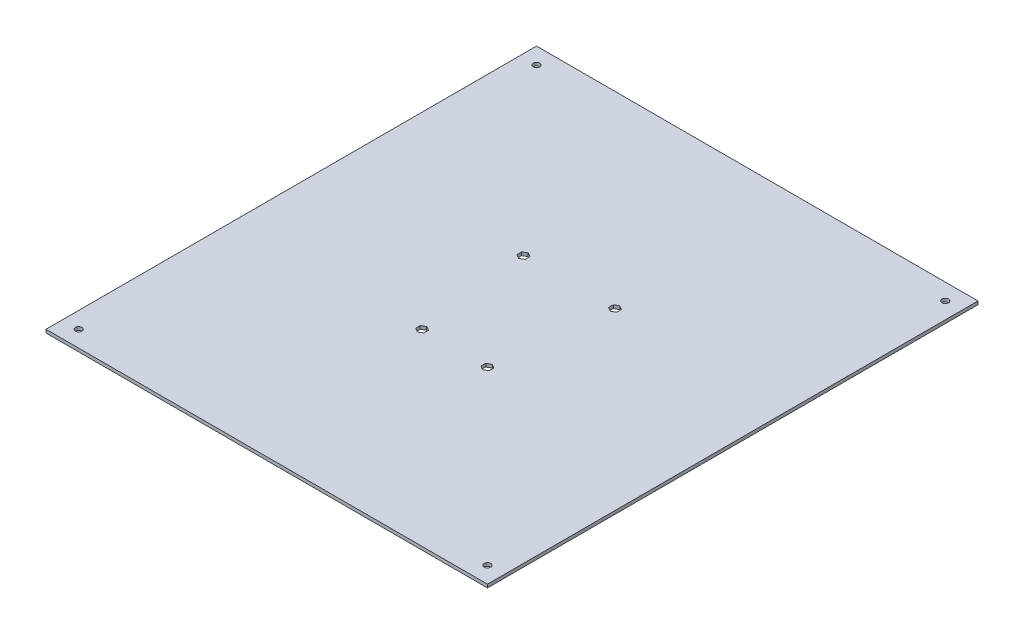
from build123d import *

# Parameters (mm, degrees)
SKETCH1_W           = 270
SKETCH1_H           = 300
SKETCH1_R           = 2
BOSS_EXTRUDE1_DEPTH = 2
CUT_EXTRUDE1_DEPTH  = 145


with BuildPart() as part:
    # Sketch1 → Boss-Extrude1 (new body)
    with BuildSketch(Plane(origin=(0, 0, 0), x_dir=(1, 0, 0), z_dir=(0, 1, 0))):
        with Locations((135, 150)):
            Rectangle(SKETCH1_W, SKETCH1_H)
        with Locations(Location((10, 290, 0), (0, 0, 270))):
            Circle(SKETCH1_R, mode=Mode.SUBTRACT)
        with Locations(Location((10, 10, 0), (0, 0, 90))):
            Circle(SKETCH1_R, mode=Mode.SUBTRACT)
        with Locations(Location((260, 10, 0), (0, 0, 270))):
            Circle(SKETCH1_R, mode=Mode.SUBTRACT)
        with Locations(Location((260, 290, 0), (0, 0, 90))):
            Circle(SKETCH1_R, mode=Mode.SUBTRACT)
    extrude(amount=BOSS_EXTRUDE1_DEPTH)

    # Sketch2 → Cut-Extrude1 (cut)
    with BuildSketch(Plane(origin=(0, 2, 0), x_dir=(1, 0, 0), z_dir=(0, 1, 0))):
        Polygon((162.945085498, 182.113771019), (165.472090368, 183.509328156), (165.527004869, 186.395557137), (163.054914502, 187.886228981), (160.527909632, 186.490671844), (160.472995131, 183.604442863), align=None)
        Polygon((154.925944651, 112.114198701), (157.462149561, 113.492965537), (157.53620491, 116.378766836), (155.074055349, 117.885801299), (152.537850439, 116.507034463), (152.46379509, 113.621233164), align=None)
        Polygon((115.074055349, 112.114198701), (117.53620491, 113.621233164), (117.462149561, 116.507034463), (114.925944651, 117.885801299), (112.46379509, 116.378766836), (112.537850439, 113.492965537), align=None)
        Polygon((107.054914502, 182.113771019), (109.527004869, 183.604442863), (109.472090368, 186.490671844), (106.945085498, 187.886228981), (104.472995131, 186.395557137), (104.527909632, 183.509328156), align=None)
    extrude(amount=-CUT_EXTRUDE1_DEPTH, mode=Mode.SUBTRACT)


solid = part.part
